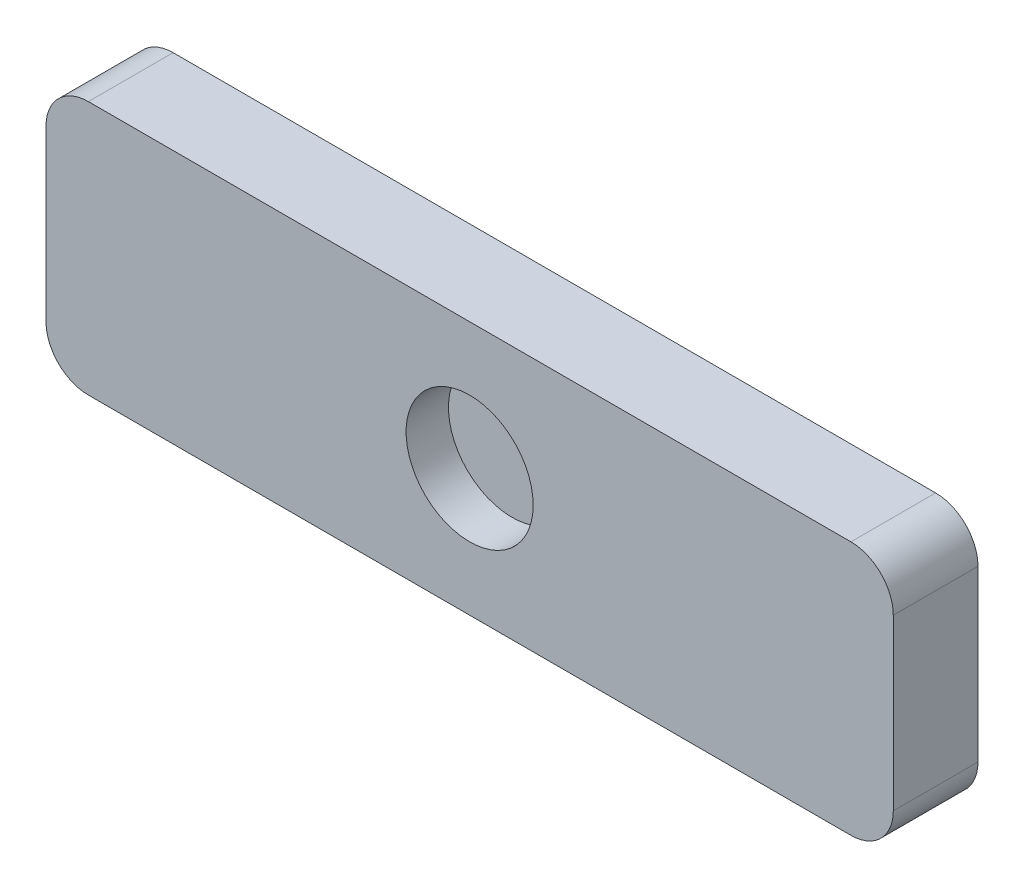
from build123d import *

# Parameters (mm, degrees)
SKETCH1_W           = 10000
SKETCH1_H           = 3000
BOSS_EXTRUDE1_DEPTH = 1000
FILLET1_R           = 500
FILLET2_R           = 500
SKETCH3_R           = 750
CUT_EXTRUDE2_DEPTH  = 500


with BuildPart() as part:
    # Sketch1 → Boss-Extrude1 (new body)
    with BuildSketch(Plane.XY):
        Rectangle(SKETCH1_W, SKETCH1_H)
    extrude(amount=BOSS_EXTRUDE1_DEPTH)

    # Fillet1
    fillet1_edges = [part.edges().sort_by_distance(p)[0] for p in [
        (-5000, 1500, 500),
    ]]
    fillet(fillet1_edges, radius=FILLET1_R)

    # Fillet2
    fillet2_edges = [part.edges().sort_by_distance(p)[0] for p in [
        (5000, -1500, 500),
        (-5000, -1500, 500),
        (5000, 1500, 500),
    ]]
    fillet(fillet2_edges, radius=FILLET2_R)

    # Sketch3 → Cut-Extrude2 (cut)
    with BuildSketch(Plane.XY.offset(1000)):
        Circle(SKETCH3_R)
    extrude(amount=-CUT_EXTRUDE2_DEPTH, mode=Mode.SUBTRACT)


solid = part.part
